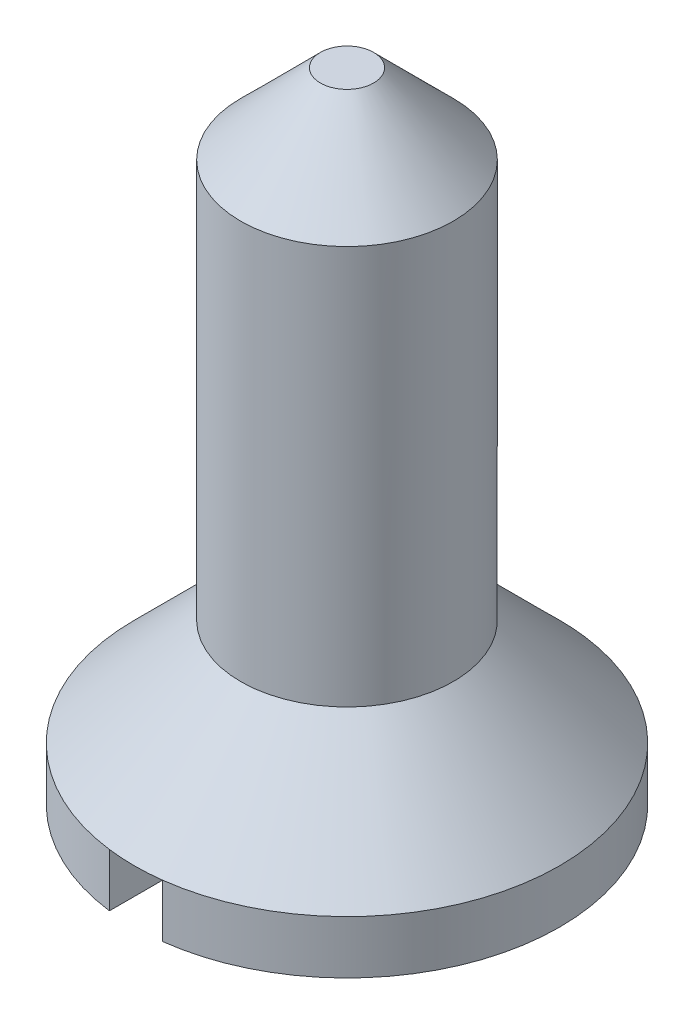
from build123d import *

# Parameters (mm, degrees)
SKETCH_1_W          = 2
SKETCH_1_H          = 9
SKETCH_2_W          = 1
SKETCH_2_H          = 1
CUT_EXTRUDE_1_DEPTH = 10
CHAMFER_1_SIZE      = 1.5


with BuildPart() as part:
    # Эскиз1 → Повернуть1 (revolve)
    with BuildSketch(Plane.XY):
        with Locations((-1, 7.5)):
            Rectangle(SKETCH_1_W, SKETCH_1_H)
        Polygon((-4, 0), (0, 0), (0, 3), (-2, 3), (-4, 1), align=None)
    revolve(axis=Axis((0, 12, 0), (0, -1, 0)))

    # Эскиз2 → Вырез-Вытянуть1 (cut, symmetric)
    with BuildSketch(Plane.XY):
        with Locations((0, 0.5)):
            Rectangle(SKETCH_2_W, SKETCH_2_H)
    extrude(amount=CUT_EXTRUDE_1_DEPTH, both=True, mode=Mode.SUBTRACT)

    # Фаска1
    chamfer_1_edges = [part.edges().sort_by_distance(p)[0] for p in [
        (2, 12, 0),
    ]]
    chamfer(chamfer_1_edges, length=CHAMFER_1_SIZE)


solid = part.part
